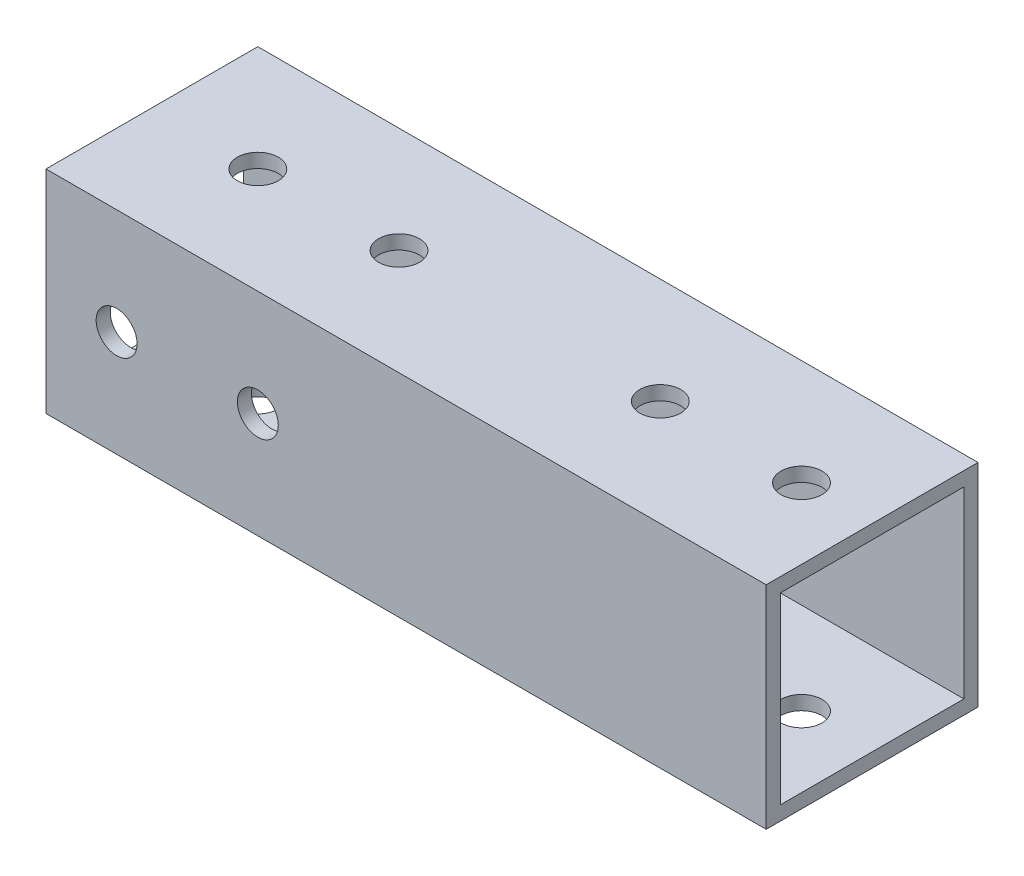
from build123d import *

# Parameters (mm, degrees)
SKETCH_1_W          = 15
SKETCH_1_H          = 15
SKETCH_1_W_2        = 13
SKETCH_1_H_2        = 13
EXTRUDE_1_DEPTH     = 51
SKETCH_2_R          = 1.45
CUT_EXTRUDE_1_DEPTH = 54.686590505
SKETCH_3_R          = 1.45
CUT_EXTRUDE_2_DEPTH = 54.686590505


with BuildPart() as part:
    # 草图1 → 凸台-拉伸1 (new body)
    with BuildSketch(Plane(origin=(0, 0, 0), x_dir=(0, 0, -1), z_dir=(1, 0, 0))):
        Rectangle(SKETCH_1_W, SKETCH_1_H)
        Rectangle(SKETCH_1_W_2, SKETCH_1_H_2, mode=Mode.SUBTRACT)
    extrude(amount=EXTRUDE_1_DEPTH)

    # 草图2 → 切除-拉伸1 (cut, through all)
    with BuildSketch(Plane(origin=(0, 7.5, 0), x_dir=(1, 0, 0), z_dir=(0, 1, 0))):
        with Locations(Location((7.5, 0, 0), (0, 0, 270))):
            Circle(SKETCH_2_R)
        with Locations(Location((17.5, 0, 0), (0, 0, 270))):
            Circle(SKETCH_2_R)
        with Locations(Location((46, 0, 0), (0, 0, 270))):
            Circle(SKETCH_2_R)
        with Locations(Location((36, 0, 0), (0, 0, 270))):
            Circle(SKETCH_2_R)
    extrude(amount=-CUT_EXTRUDE_1_DEPTH, mode=Mode.SUBTRACT)

    # 草图3 → 切除-拉伸2 (cut, through all)
    with BuildSketch(Plane.XY.offset(7.5)):
        with Locations((5, 0)):
            Circle(SKETCH_3_R)
        with Locations((15, 0)):
            Circle(SKETCH_3_R)
    extrude(amount=-CUT_EXTRUDE_2_DEPTH, mode=Mode.SUBTRACT)


solid = part.part
